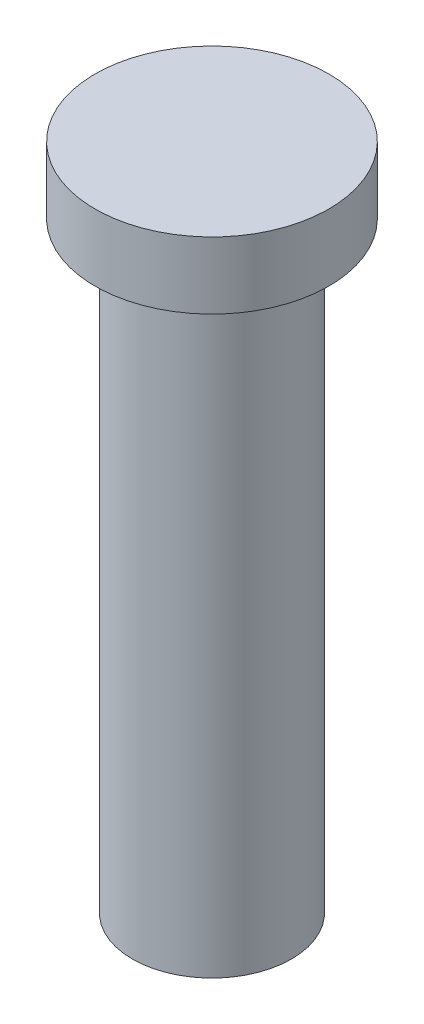
from build123d import *


with BuildPart() as part:
    # Sketch1 → Revolve1 (revolve)
    with BuildSketch(Plane.XY, mode=Mode.PRIVATE) as revolve1_sk:
        Polygon((0, 0), (4.7625, 0), (4.7625, 36), (7, 36), (7, 40), (0, 40), align=None)
    revolve(revolve1_sk.sketch.rotate(Axis((0, 0, 0), (0, 1, 0)), 90), axis=Axis((0, 0, 0), (0, 1, 0)))


solid = part.part
